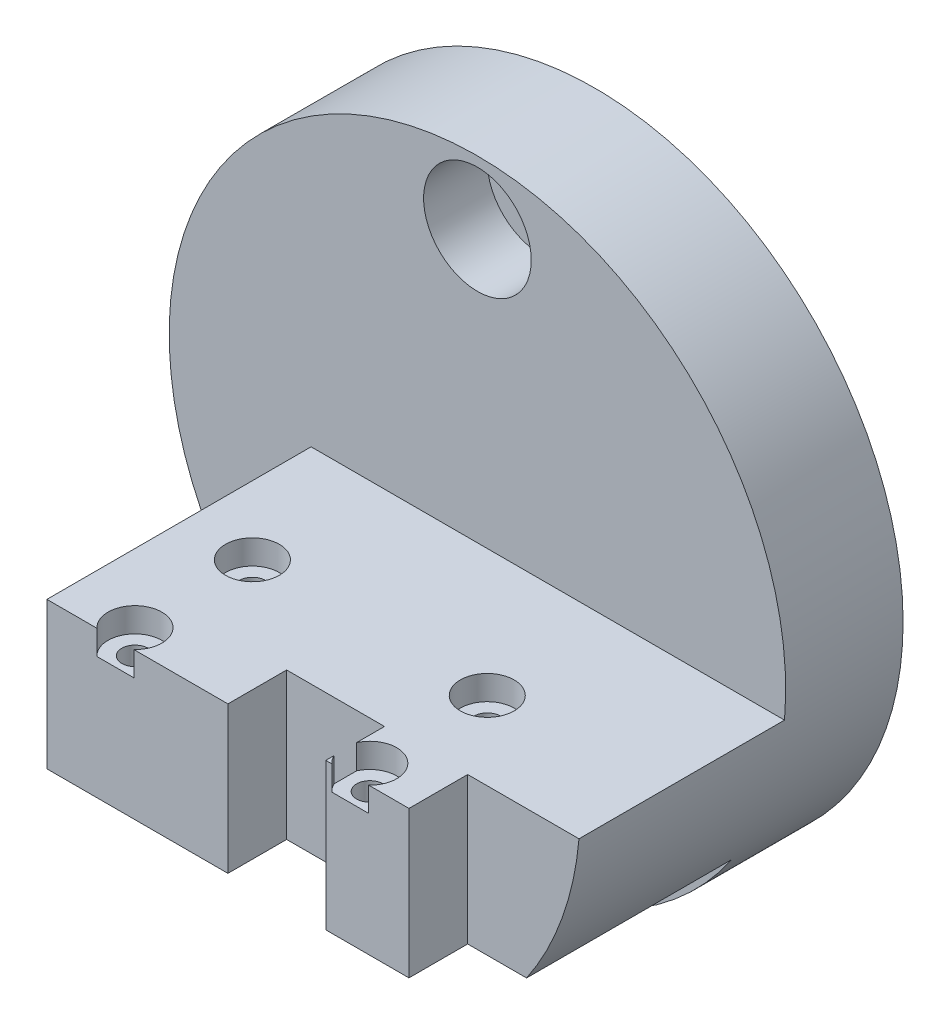
from build123d import *

# Parameters (mm, degrees)
SKETCH2_R                        = 31.5
BOSS_EXTRUDE1_DEPTH              = 12
CBORE_FOR_M6_SHCS1_D             = 6.6
CBORE_FOR_M6_SHCS1_CBORE_D       = 11
CBORE_FOR_M6_SHCS1_CBORE_DEPTH   = 6.5
SKETCH5_R                        = 3.15
CUT_EXTRUDE1_DEPTH               = 6.5
BOSS_EXTRUDE2_DEPTH              = 27
CBORE_FOR_M2_5_SHCS1_D           = 2.7
CBORE_FOR_M2_5_SHCS1_CBORE_D     = 5.5
CBORE_FOR_M2_5_SHCS1_CBORE_DEPTH = 2.5
SKETCH9_W                        = 14.384523908
SKETCH9_H                        = 27
SKETCH9_W_2                      = 10
SKETCH9_H_2                      = 6
SKETCH9_W_3                      = 11.37493753
CUT_EXTRUDE2_DEPTH               = 15


with BuildPart() as part:
    # Sketch2 → Boss-Extrude1 (new body)
    with BuildSketch(Plane.XY):
        Circle(SKETCH2_R)
    extrude(amount=BOSS_EXTRUDE1_DEPTH)

    # CBORE for M6 SHCS1 (through all)
    with Locations(Plane.XY.offset(12)):
        with Locations((0, 25), (0, -25)):
            CounterBoreHole(CBORE_FOR_M6_SHCS1_D / 2, CBORE_FOR_M6_SHCS1_CBORE_D / 2, CBORE_FOR_M6_SHCS1_CBORE_DEPTH)

    # Sketch5 → Cut-Extrude1 (cut)
    with BuildSketch(Plane(origin=(0, 0, 0), x_dir=(-1, 0, 0), z_dir=(0, 0, -1))):
        with Locations((17.67766953, 17.67766953)):
            Circle(SKETCH5_R)
    extrude(amount=-CUT_EXTRUDE1_DEPTH, mode=Mode.SUBTRACT)

    # Sketch6 → Boss-Extrude2 (add)
    with BuildSketch(Plane(origin=(0, 0, 12), x_dir=(-1, 0, 0), z_dir=(0, 0, -1))):
        with BuildLine():
            Line((-31.379730719, -2.75), (31.379730719, -2.75))
            ThreePointArc((31.379730719, -2.75), (29.665019709, -10.594177913), (26.022826518, -17.75))
            Line((26.022826518, -17.75), (-26.022826518, -17.75))
            ThreePointArc((-26.022826518, -17.75), (-29.665019709, -10.594177913), (-31.379730719, -2.75))
        make_face()
    extrude(amount=-BOSS_EXTRUDE2_DEPTH)

    # CBORE for M2.5 SHCS1 (through all)
    with Locations(Plane(origin=(0, -2.75, 0), x_dir=(1, 0, 0), z_dir=(0, 1, 0))):
        with Locations((-9.995206811, -25), (14.004793189, -37), (-9.995206811, -37), (14.004793189, -25)):
            CounterBoreHole(CBORE_FOR_M2_5_SHCS1_D / 2, CBORE_FOR_M2_5_SHCS1_CBORE_D / 2, CBORE_FOR_M2_5_SHCS1_CBORE_DEPTH)

    # Sketch9 → Cut-Extrude2 (cut)
    with BuildSketch(Plane(origin=(0, -2.75, 0), x_dir=(1, 0, 0), z_dir=(0, 1, 0))):
        with Locations((-24.187468765, -25.5)):
            Rectangle(SKETCH9_W, SKETCH9_H)
        with Locations((6.504793189, -36)):
            Rectangle(SKETCH9_W_2, SKETCH9_H_2)
        with Locations((25.692261954, -36)):
            Rectangle(SKETCH9_W_3, SKETCH9_H_2)
    extrude(amount=-CUT_EXTRUDE2_DEPTH, mode=Mode.SUBTRACT)


solid = part.part
